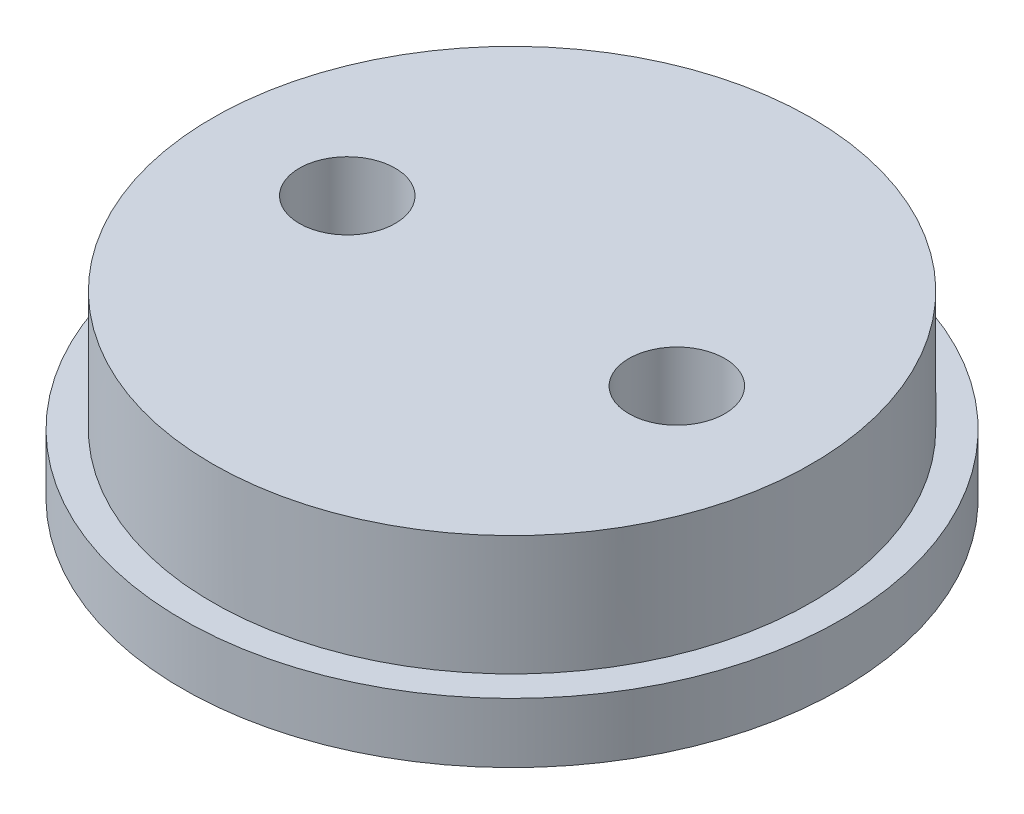
from build123d import *

# Parameters (mm, degrees)
SKETCH1_R           = 10
BOSS_EXTRUDE1_DEPTH = 6
SKETCH4_R           = 11
BOSS_EXTRUDE2_DEPTH = 2
SKETCH3_R           = 1.6
CUT_EXTRUDE2_DEPTH  = 15


with BuildPart() as part:
    # Sketch1 → Boss-Extrude1 (new body)
    with BuildSketch(Plane(origin=(0, 0, 0), x_dir=(1, 0, 0), z_dir=(0, 1, 0))):
        with Locations(Location((0, 0, 0), (0, 0, 270))):
            Circle(SKETCH1_R)
    extrude(amount=BOSS_EXTRUDE1_DEPTH)

    # Sketch4 → Boss-Extrude2 (add)
    with BuildSketch(Plane.XZ):
        with Locations(Location((0, 0, 0), (0, 0, 270))):
            Circle(SKETCH4_R)
    extrude(amount=-BOSS_EXTRUDE2_DEPTH)

    # Sketch3 → Cut-Extrude2 (cut)
    with BuildSketch(Plane(origin=(0, 0, 0), x_dir=(1, 0, 0), z_dir=(0, 1, 0))):
        with Locations(Location((-5.5, 0, 0), (0, 0, 270))):
            Circle(SKETCH3_R)
        with Locations(Location((5.5, 0, 0), (0, 0, 270))):
            Circle(SKETCH3_R)
    extrude(amount=CUT_EXTRUDE2_DEPTH, mode=Mode.SUBTRACT)


solid = part.part
